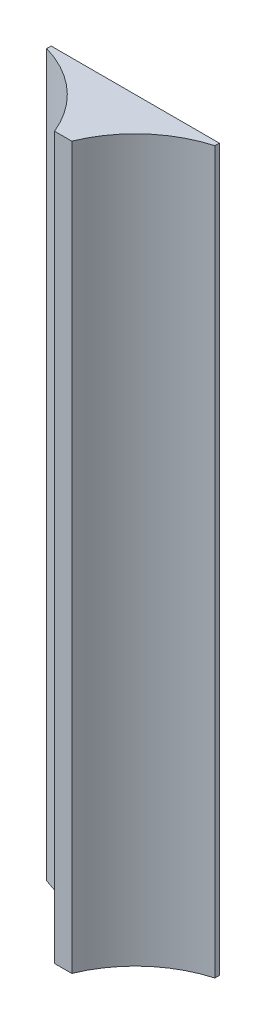
from build123d import *

# Parameters (mm, degrees)
BOSS_EXTRUDE1_DEPTH = 60


with BuildPart() as part:
    # Sketch1 → Boss-Extrude1 (new body)
    with BuildSketch(Plane(origin=(0, 0, 0), x_dir=(1, 0, 0), z_dir=(0, 1, 0))):
        with BuildLine():
            Line((-0.716915426, 0), (0.716915426, 0))
            ThreePointArc((0.716915426, 0), (3.210792252, 3.53742677), (7, 5.629008568))
            Line((7, 5.629008568), (7, 6))
            Line((7, 6), (-7, 6))
            Line((-7, 6), (-7, 5.629008568))
            ThreePointArc((-7, 5.629008568), (-3.210792252, 3.53742677), (-0.716915426, 0))
        make_face()
    extrude(amount=BOSS_EXTRUDE1_DEPTH)


solid = part.part
